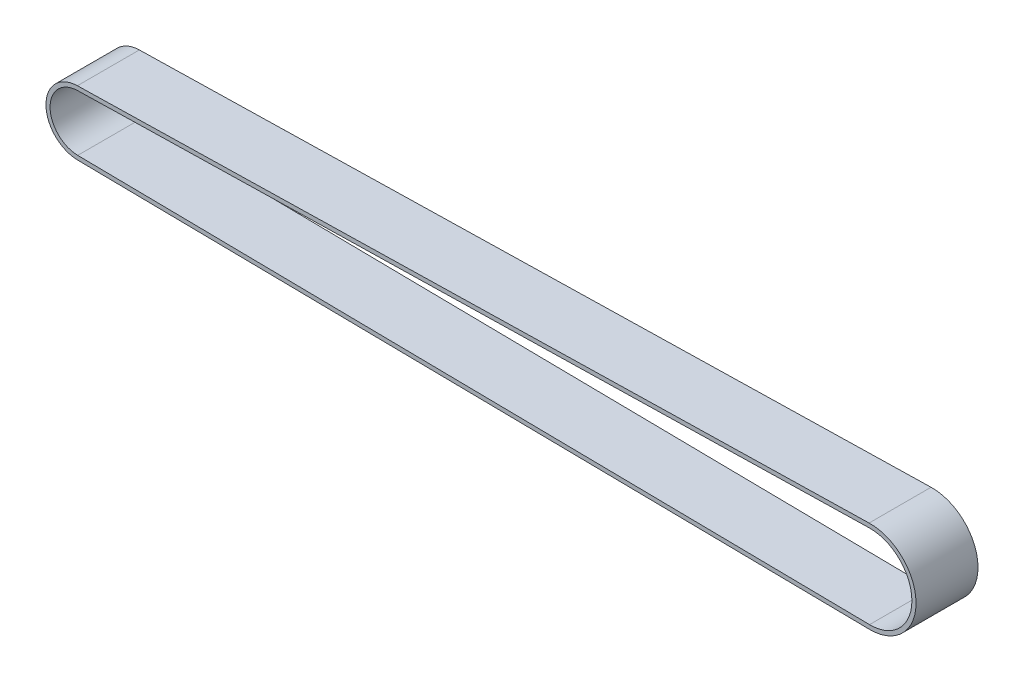
from build123d import *

# Parameters (mm, degrees)
EXTRUDE_THIN1_DEPTH = 7.5


with BuildPart() as part:
    # Sketch2 → Extrude-Thin1 (new, symmetric)
    with BuildSketch(Plane.XY):
        with BuildLine():
            Line((191.563102009, -10.323528616), (-0.103264027, -7.779314657))
            ThreePointArc((-0.103264027, -7.779314657), (-7.779932179, -0.032485232), (-0.168224601, 7.778181052))
            Line((-0.168224601, 7.778181052), (191.470211729, 11.922890378))
            ThreePointArc((191.470211729, 11.922890378), (202.835667279, 0.846943591), (191.563102009, -10.323528616))
        make_face()
        with BuildLine():
            Line((191.576375021, -9.323616706), (-0.089991016, -6.779402748))
            ThreePointArc((-0.089991016, -6.779402748), (-6.779940896, -0.028309752), (-0.146601902, 6.77841485))
            Line((-0.146601902, 6.77841485), (191.491834428, 10.923124176))
            ThreePointArc((191.491834428, 10.923124176), (201.835675997, 0.842768112), (191.576375021, -9.323616706))
        make_face(mode=Mode.SUBTRACT)
    extrude(amount=EXTRUDE_THIN1_DEPTH, both=True)


solid = part.part
